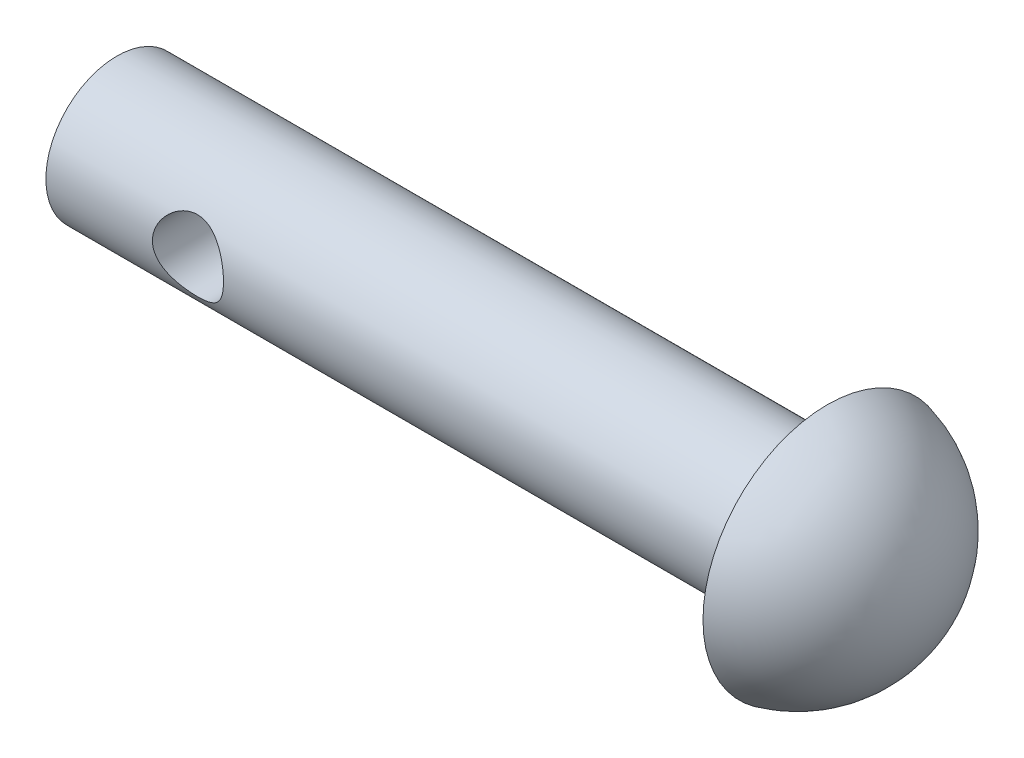
from build123d import *

# Parameters (mm, degrees)
SKETCH1_R               = 2
BOSS_EXTRUDE1_DEPTH     = 20
CUT_EXTRUDE1_DEPTH      = 21.199009877
CUT_EXTRUDE1_DEPTH_BACK = 21.199009877
SKETCH2_R               = 1


with BuildPart() as part:
    # Sketch1 → Boss-Extrude1 (new body)
    with BuildSketch(Plane(origin=(0, 0, 0), x_dir=(0, 0, -1), z_dir=(1, 0, 0))):
        Circle(SKETCH1_R)
    extrude(amount=-BOSS_EXTRUDE1_DEPTH)

    # Sketch2 → Cut-Extrude1 (cut, two sides: drawn at the far end of the back side and taken through both)
    with BuildSketch(Plane.XY.offset(-CUT_EXTRUDE1_DEPTH_BACK)):
        with Locations((-16, 0)):
            Circle(SKETCH2_R)
    extrude(amount=CUT_EXTRUDE1_DEPTH + CUT_EXTRUDE1_DEPTH_BACK, mode=Mode.SUBTRACT)

    # Sketch3 → Revolve1 (revolve)
    with BuildSketch(Plane(origin=(0, 0, 0), x_dir=(1, 0, 0), z_dir=(0, 1, 0))):
        with BuildLine():
            Line((2.757385023, 0), (0, 0))
            Line((0, 0), (0, 3.5))
            ThreePointArc((0, 3.5), (1.985229955, 2.227844932), (2.757385023, 0))
        make_face()
    revolve(axis=Axis((-7.558889504, 0, 0), (1, 0, 0)))


solid = part.part
